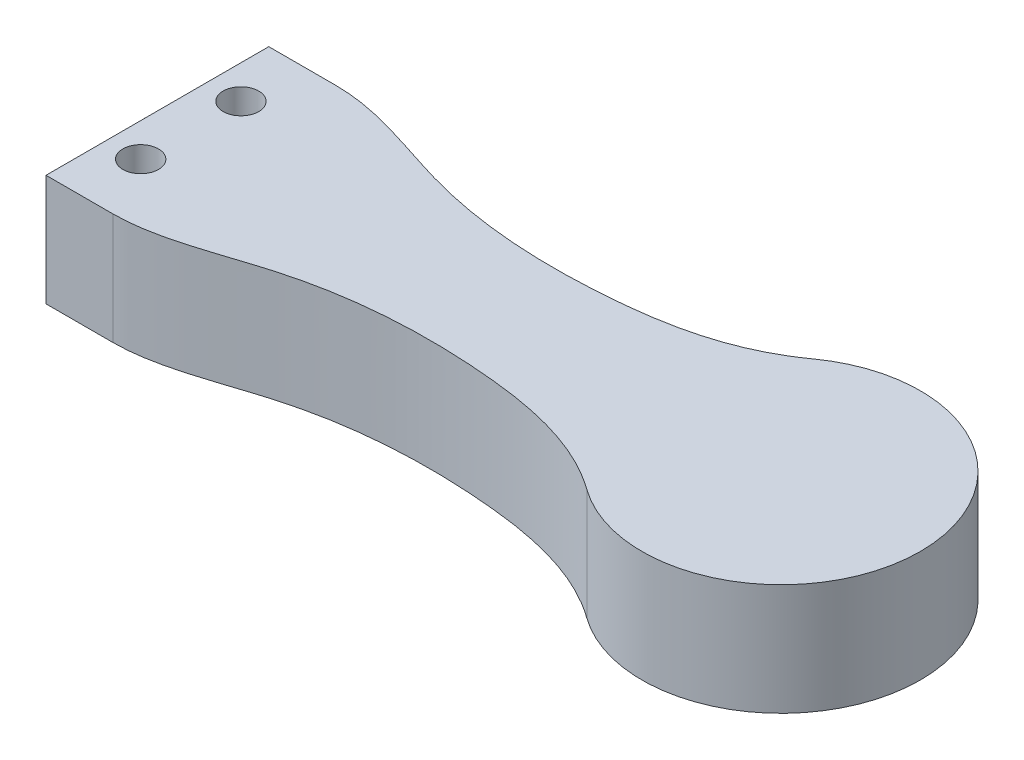
from build123d import *

# Parameters (mm, degrees)
SKETCH1_R           = 1.6
BOSS_EXTRUDE1_DEPTH = 10


with BuildPart() as part:
    # Sketch1 → Boss-Extrude1 (new body)
    with BuildSketch(Plane(origin=(0, 0, 0), x_dir=(1, 0, 0), z_dir=(0, 1, 0))):
        with BuildLine():
            Line((-3, 14.5), (3, 14.5))
            add(Edge.make_bspline(
                [(3, 14.5), (7.114682306, 14.5), (16.320193537, 10.316763311), (31.07742048, 9.595600445), (41.442510879, 11.590070739), (45.709603601, 14.653822942)],
                knots=[0, 0, 0, 0, 0.28514411, 0.663251595, 1, 1, 1, 1], degree=3))
            ThreePointArc((45.709603601, 14.653822942), (65.5, 4.5), (45.709603601, -5.653822942))
            add(Edge.make_bspline(
                [(3, -5.5), (7.114682306, -5.5), (16.320193537, -1.316763311), (31.07742048, -0.595600445), (41.442510879, -2.590070739), (45.709603601, -5.653822942)],
                knots=[0, 0, 0, 0, 0.28514411, 0.663251595, 1, 1, 1, 1], degree=3))
            Line((3, -5.5), (-3, -5.5))
            Line((-3, -5.5), (-3, 14.5))
        make_face()
        with Locations(Location((0, 0, 0), (0, 0, 270))):
            Circle(SKETCH1_R, mode=Mode.SUBTRACT)
        with Locations(Location((0, 9, 0), (0, 0, 270))):
            Circle(SKETCH1_R, mode=Mode.SUBTRACT)
    extrude(amount=BOSS_EXTRUDE1_DEPTH)


solid = part.part
